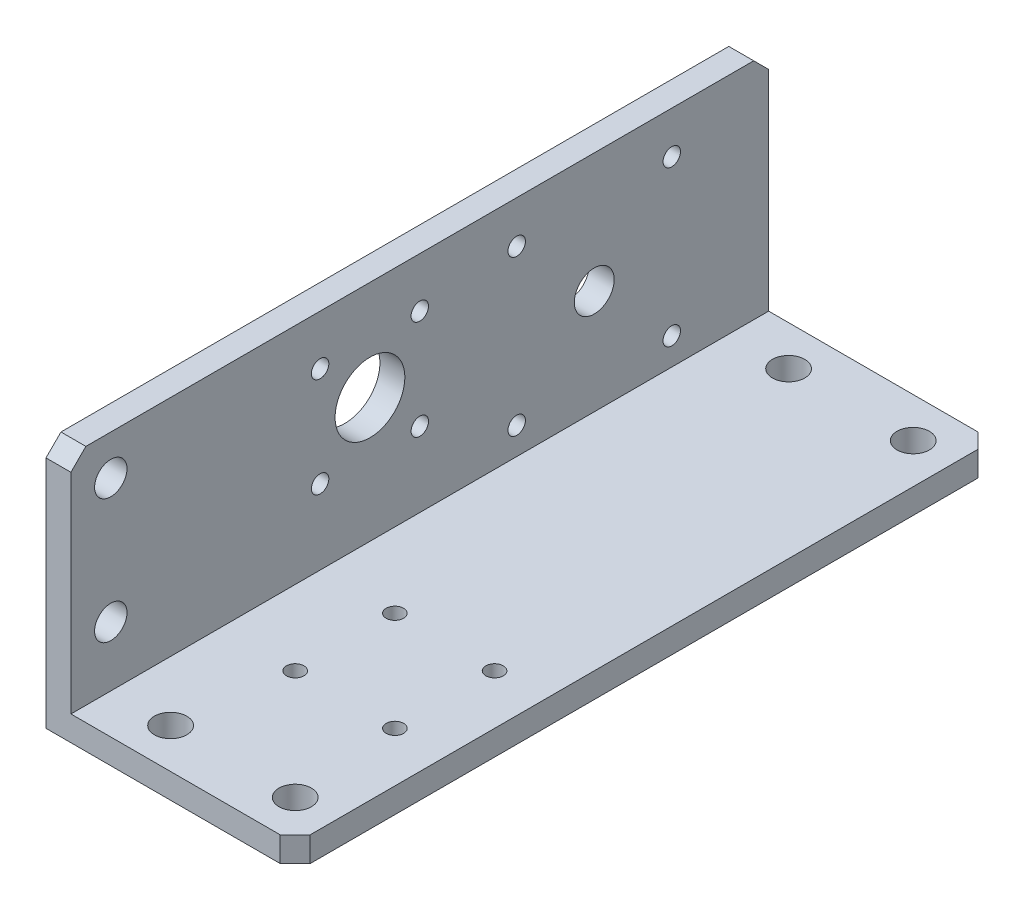
from build123d import *

# Parameters (mm, degrees)
ESTRUSIONE_ESTRUSIONE1_DEPTH = 140
FORO_6_5_6_5_1_D             = 6.5
FORO_6_5_6_5_2_D             = 6.5
FORO_6_5_6_5_2_DEPTH         = 5
FORO_6_5_6_5_2_TIP           = 1.952797012
TAGLIO_ESTRUSIONE3_REACH     = 158.844
SCHIZZO10_R                  = 1.75
SCHIZZO10_R_2                = 7
TAGLIO_ESTRUSIONE4_REACH     = 158.844
SCHIZZO11_R                  = 1.75
TAGLIO_ESTRUSIONE6_REACH     = 158.844
SCHIZZO13_R                  = 1.75
SCHIZZO13_R_2                = 4
SMUSSO1_SIZE                 = 3


with BuildPart() as part:
    # Schizzo1 → Estrusione-Estrusione1 (new body)
    with BuildSketch(Plane.XY):
        Polygon((0, 0), (0, 50), (5, 50), (5, 5), (50, 5), (50, 0), align=None)
    extrude(amount=ESTRUSIONE_ESTRUSIONE1_DEPTH)

    # Foro Ø6.5 (6.5)-1 (through all)
    with Locations(Plane(origin=(0, 0, 0), x_dir=(-1, 0, 0), z_dir=(0, -1, 0))):
        with Locations((-17, -132), (-42, -132)):
            foro_6_5_6_5_1 = Hole(FORO_6_5_6_5_1_D / 2)

    # Foro Ø6.5 (6.5)-2
    with Locations(Plane.ZY):
        with Locations((132, 42), (132, 17)):
            Hole(FORO_6_5_6_5_2_D / 2, depth=FORO_6_5_6_5_2_DEPTH)
            with Locations((0, 0, -(FORO_6_5_6_5_2_DEPTH + FORO_6_5_6_5_2_TIP / 2))):  # 118° drill point
                Cone(0, FORO_6_5_6_5_2_D / 2, FORO_6_5_6_5_2_TIP, mode=Mode.SUBTRACT)

    # Specchia1: Foro Ø6.5 (6.5)-1 across plane
    add(foro_6_5_6_5_1.mirror(Plane.XY.offset(70)), mode=Mode.SUBTRACT)

    # Schizzo10 → Taglio-Estrusione3 (cut, up to next)
    with BuildSketch(Plane.ZY, mode=Mode.PRIVATE) as taglio_estrusione3_sk1:
        with Locations((70, 40)):
            Circle(SCHIZZO10_R)
    taglio_estrusione3_tool1 = extrude(taglio_estrusione3_sk1.sketch, amount=-TAGLIO_ESTRUSIONE3_REACH, mode=Mode.PRIVATE) & part.part
    # Schizzo10 → Taglio-Estrusione3 (cut, up to next)
    with BuildSketch(Plane.ZY, mode=Mode.PRIVATE) as taglio_estrusione3_sk2:
        with Locations((90, 40)):
            Circle(SCHIZZO10_R)
    taglio_estrusione3_tool2 = extrude(taglio_estrusione3_sk2.sketch, amount=-TAGLIO_ESTRUSIONE3_REACH, mode=Mode.PRIVATE) & part.part
    # Schizzo10 → Taglio-Estrusione3 (cut, up to next)
    with BuildSketch(Plane.ZY, mode=Mode.PRIVATE) as taglio_estrusione3_sk3:
        with Locations((90, 20)):
            Circle(SCHIZZO10_R)
    taglio_estrusione3_tool3 = extrude(taglio_estrusione3_sk3.sketch, amount=-TAGLIO_ESTRUSIONE3_REACH, mode=Mode.PRIVATE) & part.part
    # Schizzo10 → Taglio-Estrusione3 (cut, up to next)
    with BuildSketch(Plane.ZY, mode=Mode.PRIVATE) as taglio_estrusione3_sk4:
        with Locations((70, 20)):
            Circle(SCHIZZO10_R)
    taglio_estrusione3_tool4 = extrude(taglio_estrusione3_sk4.sketch, amount=-TAGLIO_ESTRUSIONE3_REACH, mode=Mode.PRIVATE) & part.part
    # Schizzo10 → Taglio-Estrusione3 (cut, up to next)
    with BuildSketch(Plane.ZY, mode=Mode.PRIVATE) as taglio_estrusione3_sk5:
        with Locations((80, 30)):
            Circle(SCHIZZO10_R_2)
    taglio_estrusione3_tool5 = extrude(taglio_estrusione3_sk5.sketch, amount=-TAGLIO_ESTRUSIONE3_REACH, mode=Mode.PRIVATE) & part.part
    add(taglio_estrusione3_tool1.solids().sort_by_distance((0, 40, 70))[0], mode=Mode.SUBTRACT)
    add(taglio_estrusione3_tool2.solids().sort_by_distance((0, 40, 90))[0], mode=Mode.SUBTRACT)
    add(taglio_estrusione3_tool3.solids().sort_by_distance((0, 20, 90))[0], mode=Mode.SUBTRACT)
    add(taglio_estrusione3_tool4.solids().sort_by_distance((0, 20, 70))[0], mode=Mode.SUBTRACT)
    add(taglio_estrusione3_tool5.solids().sort_by_distance((0, 30, 80))[0], mode=Mode.SUBTRACT)

    # Schizzo11 → Taglio-Estrusione4 (cut, up to next)
    with BuildSketch(Plane.XZ, mode=Mode.PRIVATE) as taglio_estrusione4_sk1:
        with Locations((20, 90)):
            Circle(SCHIZZO11_R)
    taglio_estrusione4_tool1 = extrude(taglio_estrusione4_sk1.sketch, amount=-TAGLIO_ESTRUSIONE4_REACH, mode=Mode.PRIVATE) & part.part
    # Schizzo11 → Taglio-Estrusione4 (cut, up to next)
    with BuildSketch(Plane.XZ, mode=Mode.PRIVATE) as taglio_estrusione4_sk2:
        with Locations((20, 110)):
            Circle(SCHIZZO11_R)
    taglio_estrusione4_tool2 = extrude(taglio_estrusione4_sk2.sketch, amount=-TAGLIO_ESTRUSIONE4_REACH, mode=Mode.PRIVATE) & part.part
    # Schizzo11 → Taglio-Estrusione4 (cut, up to next)
    with BuildSketch(Plane.XZ, mode=Mode.PRIVATE) as taglio_estrusione4_sk3:
        with Locations((40, 110)):
            Circle(SCHIZZO11_R)
    taglio_estrusione4_tool3 = extrude(taglio_estrusione4_sk3.sketch, amount=-TAGLIO_ESTRUSIONE4_REACH, mode=Mode.PRIVATE) & part.part
    # Schizzo11 → Taglio-Estrusione4 (cut, up to next)
    with BuildSketch(Plane.XZ, mode=Mode.PRIVATE) as taglio_estrusione4_sk4:
        with Locations((40, 90)):
            Circle(SCHIZZO11_R)
    taglio_estrusione4_tool4 = extrude(taglio_estrusione4_sk4.sketch, amount=-TAGLIO_ESTRUSIONE4_REACH, mode=Mode.PRIVATE) & part.part
    add(taglio_estrusione4_tool1.solids().sort_by_distance((20, 0, 90))[0], mode=Mode.SUBTRACT)
    add(taglio_estrusione4_tool2.solids().sort_by_distance((20, 0, 110))[0], mode=Mode.SUBTRACT)
    add(taglio_estrusione4_tool3.solids().sort_by_distance((40, 0, 110))[0], mode=Mode.SUBTRACT)
    add(taglio_estrusione4_tool4.solids().sort_by_distance((40, 0, 90))[0], mode=Mode.SUBTRACT)

    # Schizzo13 → Taglio-Estrusione6 (cut, up to next)
    with BuildSketch(Plane.ZY, mode=Mode.PRIVATE) as taglio_estrusione6_sk1:
        with Locations((50.556349186, 41.556349186)):
            Circle(SCHIZZO13_R)
    taglio_estrusione6_tool1 = extrude(taglio_estrusione6_sk1.sketch, amount=-TAGLIO_ESTRUSIONE6_REACH, mode=Mode.PRIVATE) & part.part
    # Schizzo13 → Taglio-Estrusione6 (cut, up to next)
    with BuildSketch(Plane.ZY, mode=Mode.PRIVATE) as taglio_estrusione6_sk2:
        with Locations((50.556349186, 10.443650814)):
            Circle(SCHIZZO13_R)
    taglio_estrusione6_tool2 = extrude(taglio_estrusione6_sk2.sketch, amount=-TAGLIO_ESTRUSIONE6_REACH, mode=Mode.PRIVATE) & part.part
    # Schizzo13 → Taglio-Estrusione6 (cut, up to next)
    with BuildSketch(Plane.ZY, mode=Mode.PRIVATE) as taglio_estrusione6_sk3:
        with Locations((19.443650814, 10.443650814)):
            Circle(SCHIZZO13_R)
    taglio_estrusione6_tool3 = extrude(taglio_estrusione6_sk3.sketch, amount=-TAGLIO_ESTRUSIONE6_REACH, mode=Mode.PRIVATE) & part.part
    # Schizzo13 → Taglio-Estrusione6 (cut, up to next)
    with BuildSketch(Plane.ZY, mode=Mode.PRIVATE) as taglio_estrusione6_sk4:
        with Locations((19.443650814, 41.556349186)):
            Circle(SCHIZZO13_R)
    taglio_estrusione6_tool4 = extrude(taglio_estrusione6_sk4.sketch, amount=-TAGLIO_ESTRUSIONE6_REACH, mode=Mode.PRIVATE) & part.part
    # Schizzo13 → Taglio-Estrusione6 (cut, up to next)
    with BuildSketch(Plane.ZY, mode=Mode.PRIVATE) as taglio_estrusione6_sk5:
        with Locations((35, 26)):
            Circle(SCHIZZO13_R_2)
    taglio_estrusione6_tool5 = extrude(taglio_estrusione6_sk5.sketch, amount=-TAGLIO_ESTRUSIONE6_REACH, mode=Mode.PRIVATE) & part.part
    add(taglio_estrusione6_tool1.solids().sort_by_distance((0, 41.556349, 50.556349))[0], mode=Mode.SUBTRACT)
    add(taglio_estrusione6_tool2.solids().sort_by_distance((0, 10.443651, 50.556349))[0], mode=Mode.SUBTRACT)
    add(taglio_estrusione6_tool3.solids().sort_by_distance((0, 10.443651, 19.443651))[0], mode=Mode.SUBTRACT)
    add(taglio_estrusione6_tool4.solids().sort_by_distance((0, 41.556349, 19.443651))[0], mode=Mode.SUBTRACT)
    add(taglio_estrusione6_tool5.solids().sort_by_distance((0, 26, 35))[0], mode=Mode.SUBTRACT)

    # Smusso1
    smusso1_edges = [part.edges().sort_by_distance(p)[0] for p in [
        (2.5, 50, 140),
        (2.5, 50, 0),
        (50, 2.5, 140),
        (50, 2.5, 0),
    ]]
    chamfer(smusso1_edges, length=SMUSSO1_SIZE)


solid = part.part
